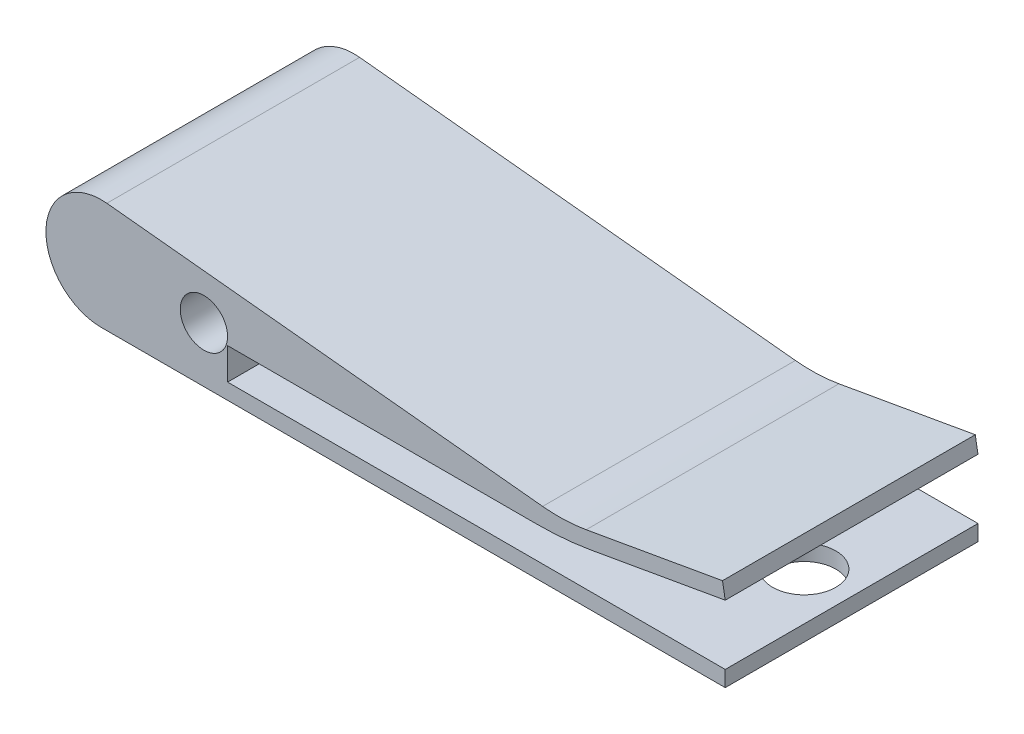
from build123d import *

# Parameters (mm, degrees)
ESTRUSIONE_ESTRUSIONE1_DEPTH = 16
RACCORDO1_R                  = 10
RACCORDO2_R                  = 20
SCHIZZO3_R                   = 1.5
TAGLIO_ESTRUSIONE1_DEPTH     = 16
SCHIZZO4_R                   = 2
TAGLIO_ESTRUSIONE2_DEPTH     = 1


with BuildPart() as part:
    # Schizzo1 → Estrusione-Estrusione1 (new body)
    with BuildSketch(Plane.XY):
        with BuildLine():
            ThreePointArc((3.856518615, 6.981794721), (0.004554283, 3.678491565), (3.5, 0))
            Line((3.5, 0), (43, 0))
            Line((43, 0), (43, 1))
            Line((43, 1), (11.5, 1))
            Line((11.5, 1), (11.5, 3))
            Line((11.5, 3), (32.826351822, 3))
            Line((32.826351822, 3), (43, 4.793888666))
            Line((43, 4.793888666), (42.826351822, 5.778696419))
            Line((42.826351822, 5.778696419), (32.826351822, 4.015426612))
            Line((32.826351822, 4.015426612), (3.856518615, 6.981794721))
        make_face()
    extrude(amount=ESTRUSIONE_ESTRUSIONE1_DEPTH)

    # Raccordo1
    raccordo1_edges = [part.edges().sort_by_distance(p)[0] for p in [
        (32.826351822, 4.015426612, 8),
    ]]
    fillet(raccordo1_edges, radius=RACCORDO1_R)

    # Raccordo2
    raccordo2_edges = [part.edges().sort_by_distance(p)[0] for p in [
        (32.826351822, 3, 8),
    ]]
    fillet(raccordo2_edges, radius=RACCORDO2_R)

    # Schizzo3 → Taglio-Estrusione1 (cut)
    with BuildSketch(Plane.XY.offset(16)):
        with Locations((10, 3.5)):
            Circle(SCHIZZO3_R)
    extrude(amount=-TAGLIO_ESTRUSIONE1_DEPTH, mode=Mode.SUBTRACT)

    # Schizzo4 → Taglio-Estrusione2 (cut)
    with BuildSketch(Plane.XZ):
        with Locations((40, 8)):
            Circle(SCHIZZO4_R)
        with Locations((15, 8)):
            Circle(SCHIZZO4_R)
    extrude(amount=-TAGLIO_ESTRUSIONE2_DEPTH, mode=Mode.SUBTRACT)


solid = part.part
